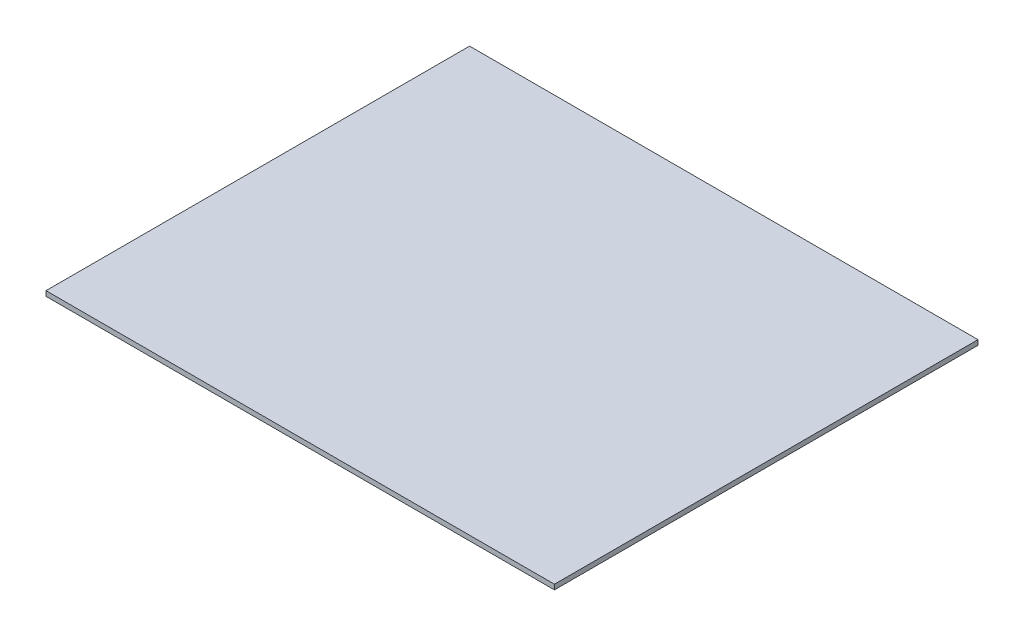
from build123d import *

# Parameters (mm, degrees)
SKETCH_1_W      = 205.999996103
SKETCH_1_H      = 171.62
EXTRUDE_1_DEPTH = 2


with BuildPart() as part:
    # Эскиз1 → Вытянуть1 (new body)
    with BuildSketch(Plane(origin=(0, 0, 0), x_dir=(1, 0, 0), z_dir=(0, 1, 0))):
        with Locations((106.852612065, -95.703529987)):
            Rectangle(SKETCH_1_W, SKETCH_1_H)
    extrude(amount=EXTRUDE_1_DEPTH)


solid = part.part
